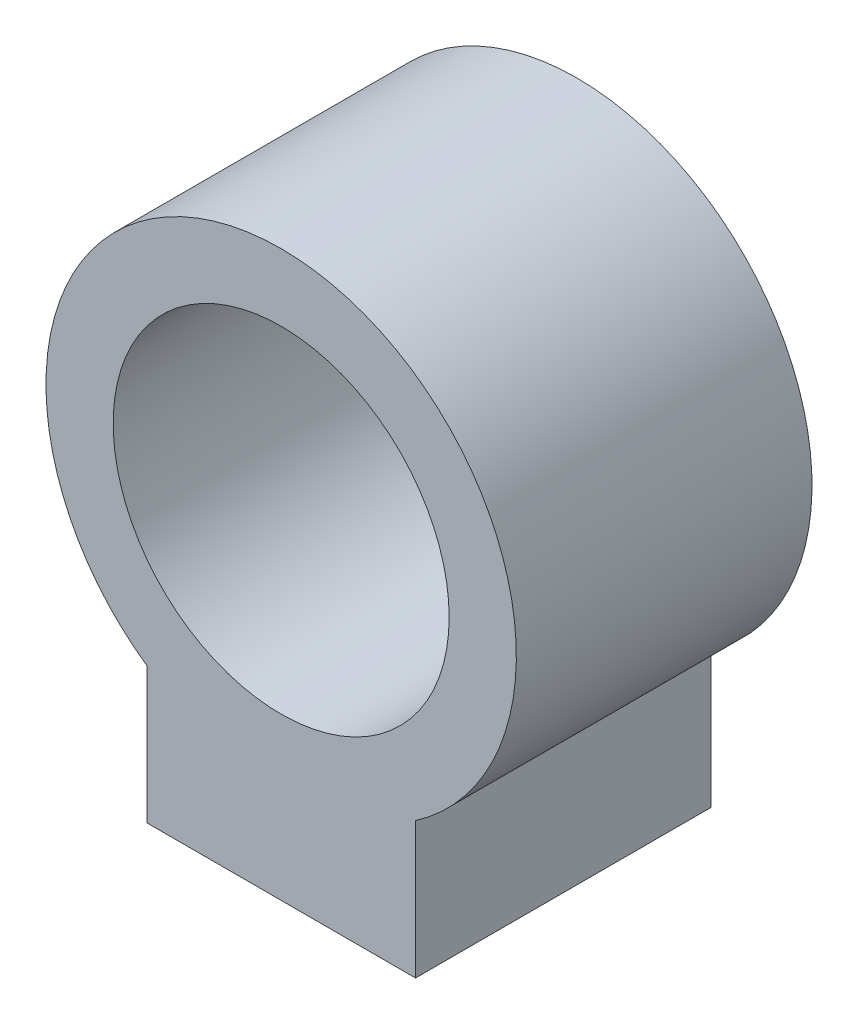
from build123d import *

# Parameters (mm, degrees)
SKETCH_1_R      = 12.5
EXTRUDE_1_DEPTH = 11


with BuildPart() as part:
    # 草图1 → 凸台-拉伸1 (new, symmetric)
    with BuildSketch(Plane.XY):
        with BuildLine():
            ThreePointArc((10, 2.638593384), (0, 34.5), (-10, 2.638593384))
            Line((-10, 2.638593384), (-10, -7.5))
            Line((-10, -7.5), (10, -7.5))
            Line((10, -7.5), (10, 2.638593384))
        make_face()
        with Locations((0, 17)):
            Circle(SKETCH_1_R, mode=Mode.SUBTRACT)
    extrude(amount=EXTRUDE_1_DEPTH, both=True)


solid = part.part
